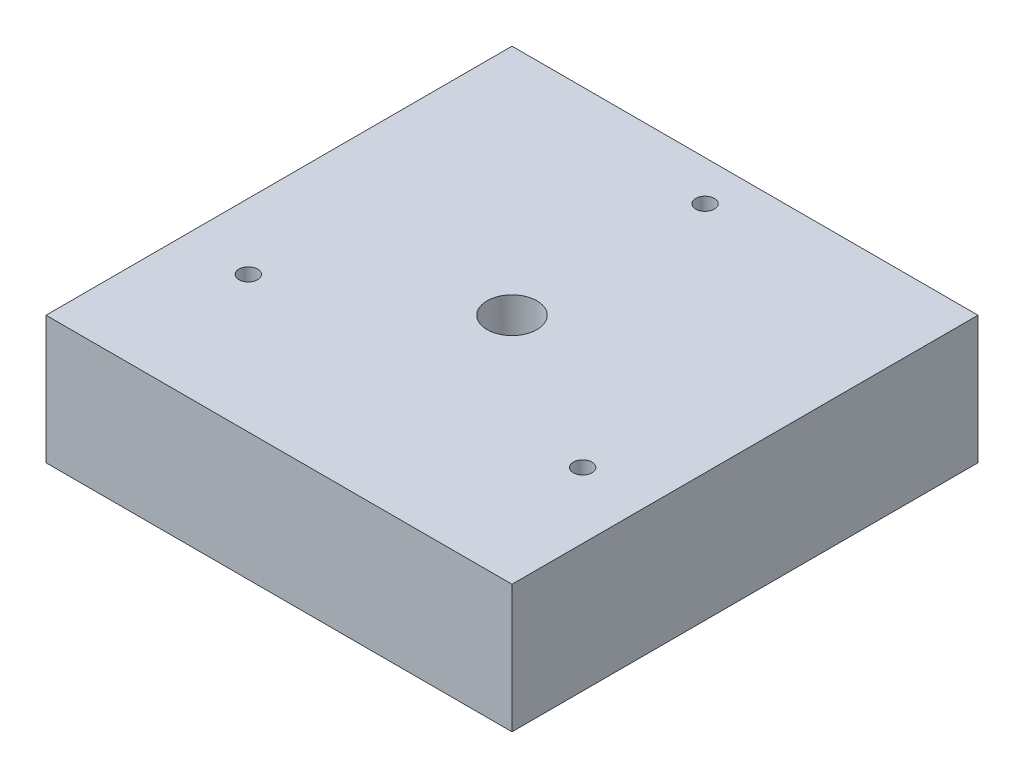
from build123d import *
from build123d.topology import SkipClean

# Parameters (mm, degrees)
SKETCH1_W                 = 44.45
SKETCH1_H                 = 44.45
SKETCH1_R                 = 2.38125
BOSS_EXTRUDE1_DEPTH       = 3.937
BOSS_EXTRUDE2_START       = 8.255
SKETCH3_W                 = 44.45
SKETCH3_H                 = 44.45
SKETCH3_R                 = 2.38125
BOSS_EXTRUDE2_DEPTH       = 8.255
F_2_56_TAPPED_HOLE1_D     = 1.778
F_2_56_TAPPED_HOLE1_DEPTH = 6.35
F_2_56_TAPPED_HOLE1_TIP   = 0.53416509


with BuildPart() as part:
    # Sketch1 → Boss-Extrude1 (new body)
    with BuildSketch(Plane(origin=(0, 0, 0), x_dir=(1, 0, 0), z_dir=(0, 1, 0))):
        Rectangle(SKETCH1_W, SKETCH1_H)
        with Locations(Location((0, 0, 0), (0, 0, 270))):
            Circle(SKETCH1_R, mode=Mode.SUBTRACT)
    extrude(amount=BOSS_EXTRUDE1_DEPTH)

    # Sketch3 → Boss-Extrude2 (add)
    with SkipClean():  # the faces are left unmerged after this step: merging them gives an invalid solid
        with BuildSketch(Plane.XZ.offset(BOSS_EXTRUDE2_START)):
            Rectangle(SKETCH3_W, SKETCH3_H)
            with Locations(Location((0, 0, 0), (0, 0, 270))):
                Circle(SKETCH3_R, mode=Mode.SUBTRACT)
        extrude(amount=-BOSS_EXTRUDE2_DEPTH)

    # #2-56 Tapped Hole1
    with Locations(Plane(origin=(0, 3.937, 0), x_dir=(1, 0, 0), z_dir=(0, 1, 0))):
        with Locations((15.947857811, -9.2075), (-15.947857811, -9.2075), (0, 18.415)):
            Hole(F_2_56_TAPPED_HOLE1_D / 2, depth=F_2_56_TAPPED_HOLE1_DEPTH)
            with Locations((0, 0, -(F_2_56_TAPPED_HOLE1_DEPTH + F_2_56_TAPPED_HOLE1_TIP / 2))):  # 118° drill point
                Cone(0, F_2_56_TAPPED_HOLE1_D / 2, F_2_56_TAPPED_HOLE1_TIP, mode=Mode.SUBTRACT)


solid = part.part
